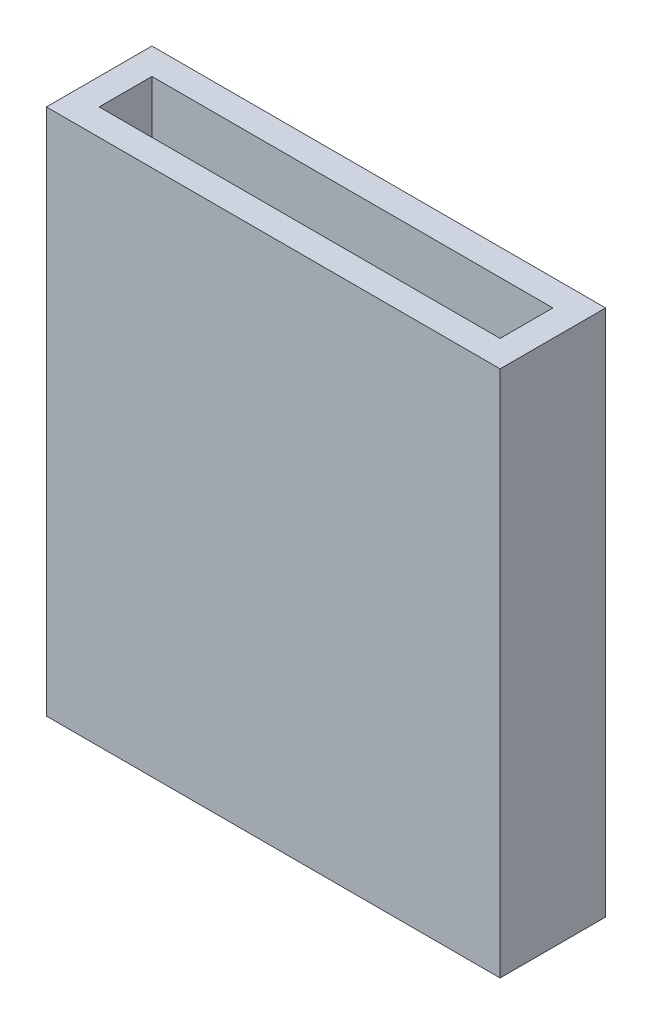
from build123d import *

# Parameters (mm, degrees)
SKETCH3_W           = 86
SKETCH3_H           = 100
BOSS_EXTRUDE1_DEPTH = 20
SKETCH5_W           = 76
SKETCH5_H           = 10
CUT_EXTRUDE1_DEPTH  = 90
SKETCH6_R           = 2
CUT_EXTRUDE2_DEPTH  = 90


with BuildPart() as part:
    # Sketch3 → Boss-Extrude1 (new body)
    with BuildSketch(Plane.XY):
        with Locations((43, 50)):
            Rectangle(SKETCH3_W, SKETCH3_H)
    extrude(amount=BOSS_EXTRUDE1_DEPTH)

    # Sketch5 → Cut-Extrude1 (cut)
    with BuildSketch(Plane(origin=(0, 100, 0), x_dir=(1, 0, 0), z_dir=(0, 1, 0))):
        with Locations((43, -10)):
            Rectangle(SKETCH5_W, SKETCH5_H)
    extrude(amount=-CUT_EXTRUDE1_DEPTH, mode=Mode.SUBTRACT)

    # Sketch6 → Cut-Extrude2 (cut)
    with BuildSketch(Plane(origin=(0, 10, 0), x_dir=(1, 0, 0), z_dir=(0, 1, 0))):
        with Locations(Location((43, -10, 0), (0, 0, 270))):
            Circle(SKETCH6_R)
    extrude(amount=-CUT_EXTRUDE2_DEPTH, mode=Mode.SUBTRACT)


solid = part.part
